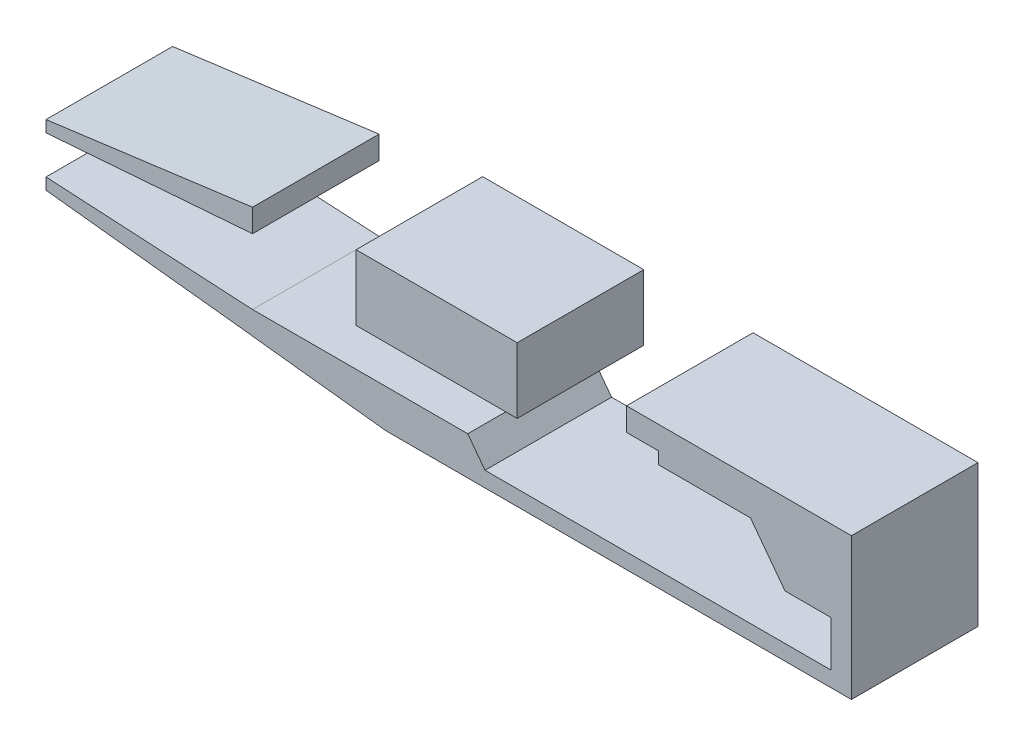
from build123d import *

# Parameters (mm, degrees)
SKETCH1_W           = 700
SKETCH1_H           = 110
BOSS_EXTRUDE1_DEPTH = 110
CUT_EXTRUDE1_DEPTH  = 120
BOSS_EXTRUDE9_DEPTH = 55


with BuildPart() as part:
    # Sketch1 → Boss-Extrude1 (new body)
    with BuildSketch(Plane(origin=(0, 0, 0), x_dir=(1, 0, 0), z_dir=(0, 1, 0))):
        Rectangle(SKETCH1_W, SKETCH1_H)
    extrude(amount=BOSS_EXTRUDE1_DEPTH)

    # Sketch3 → Cut-Extrude1 (cut)
    with BuildSketch(Plane.XY.offset(55)):
        Polygon((262.25, 79.541692384), (182.25, 79.541692384), (182.25, 90), (154.5, 90), (154.5, 110), (59.5, 110), (59.5, 53), (-80.5, 53), (-80.5, 110), (-350, 110), (-350, 73.218467101), (-170.5, 97), (-170.5, 77), (-350, 63.218467101), (-350, 30), (-170.5, 20), (16.544278488, 20), (31.544278488, 0), (332.25, 0), (332.25, 39.541692384), (292.25, 39.541692384), align=None)
        Polygon((-350, 0), (-170.5, 0), (-350, 20), align=None)
    extrude(amount=-CUT_EXTRUDE1_DEPTH, mode=Mode.SUBTRACT)


with BuildPart() as cut_extrude1_piece_1:
    # of the separate pieces the step leaves, piece 1, a body of its own (cut_extrude1_pieces)
    add(part.part.solids().sort_by_distance((332.25, 0, -55))[0])



with BuildPart() as cut_extrude1_piece_2:
    # of the separate pieces the step leaves, piece 2, a body of its own (cut_extrude1_pieces)
    add(part.part.solids().sort_by_distance((-80.5, 110, -55))[0])


with BuildPart() as cut_extrude1_piece_3:
    # of the separate pieces the step leaves, piece 3, a body of its own (cut_extrude1_pieces)
    add(part.part.solids().sort_by_distance((-350, 20, -55))[0])


with BuildPart() as cut_extrude1_piece_4:
    # of the separate pieces the step leaves, piece 4, a body of its own (cut_extrude1_pieces)
    add(part.part.solids().sort_by_distance((-350, 63.218467101, -55))[0])


with BuildPart() as cut_extrude1_piece_1_1:
    add(cut_extrude1_piece_1.part)

    add(cut_extrude1_piece_3.part)  # Boss-Extrude9 merges Cut-Extrude1 piece 3
    # Sketch5 → Boss-Extrude9 (add, symmetric)
    with BuildSketch(Plane.XY):
        Polygon((-171.496430607, 0), (-54.75215435, -13.317944804), (350, -13.317944804), (350, 0), align=None)
    extrude(amount=BOSS_EXTRUDE9_DEPTH, both=True)


solid = Compound([cut_extrude1_piece_2.part, cut_extrude1_piece_4.part, cut_extrude1_piece_1_1.part])
